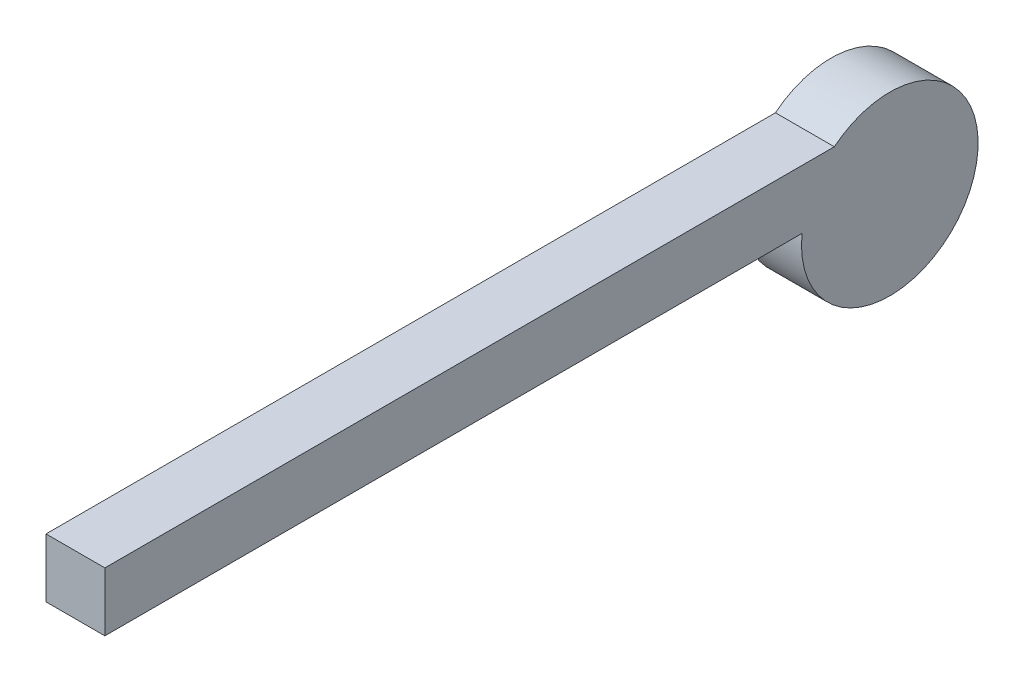
from build123d import *

# Parameters (mm, degrees)
BOSS_EXTRUDE1_DEPTH = 15


with BuildPart() as part:
    # Sketch1 → Boss-Extrude1 (new, symmetric)
    with BuildSketch(Plane(origin=(0, 0, 0), x_dir=(0, 0, -1), z_dir=(1, 0, 0))):
        with BuildLine():
            Line((-1.48e-15, 34.99999999999999), (-1.48e-15, 5))
            Line((-1.48e-15, 5), (-44.72135954999586, 4.999999999999995))
            ThreePointArc((-44.721359549995825, 4.999999999999726), (-2.5038790156662976, -44.930285886859274), (45, -1.102e-14))
            ThreePointArc((45, 0), (19.393398282202586, 40.60660171779783), (-28.28427124746052, 35.000000000001116))
            Line((-28.28427124746018, 34.99999999999999), (-1.48e-15, 34.99999999999999))
        make_face()
        with BuildLine():
            Line((-44.72135954999586, 4.999999999999995), (-1.48e-15, 5))
            Line((-1.48e-15, 5), (-1.48e-15, 34.99999999999999))
            Line((-1.48e-15, 34.99999999999999), (-28.28427124746018, 34.99999999999999))
            ThreePointArc((-28.28427124746052, 35.000000000001116), (-39.464611134960485, 21.622776601684457), (-44.721359549995825, 4.999999999999726))
        make_face()
        with BuildLine():
            Line((-400, 4.99999999999995), (-44.72135954999586, 4.999999999999995))
            ThreePointArc((-44.721359549995825, 4.999999999999726), (-39.464611134960485, 21.622776601684457), (-28.28427124746052, 35.000000000001116))
            Line((-28.28427124746018, 34.99999999999999), (-400, 34.99999999999995))
            Line((-400, 34.99999999999995), (-400, 4.99999999999995))
        make_face()
    extrude(amount=BOSS_EXTRUDE1_DEPTH, both=True)


solid = part.part
